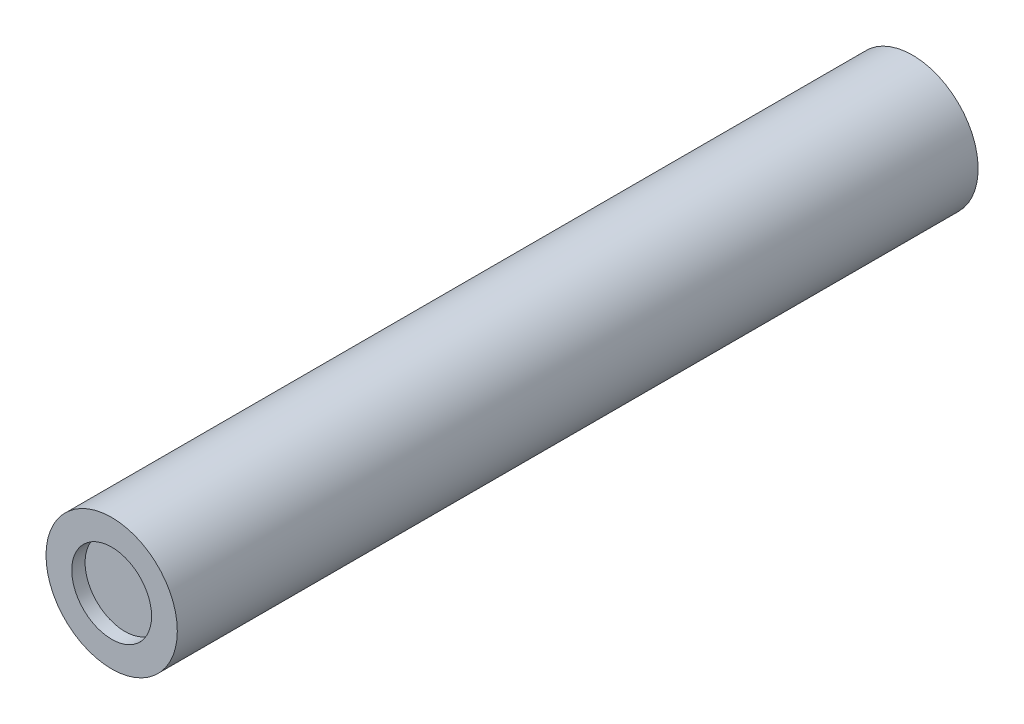
from build123d import *

# Parameters (mm, degrees)
SKETCH1_R           = 12.5
BOSS_EXTRUDE1_DEPTH = 155
SKETCH2_R           = 15.099425383
CUT_EXTRUDE1_DEPTH  = 2.54
SKETCH3_R           = 7.600027619
CUT_EXTRUDE2_DEPTH  = 2.54


with BuildPart() as part:
    # Sketch1 → Boss-Extrude1 (new body)
    with BuildSketch(Plane.XY):
        Circle(SKETCH1_R)
    extrude(amount=BOSS_EXTRUDE1_DEPTH)

    # Sketch2 → Cut-Extrude1 (cut)
    with BuildSketch(Plane(origin=(0, 0, 0), x_dir=(-1, 0, 0), z_dir=(0, 0, -1))):
        Circle(SKETCH2_R)
    extrude(amount=-CUT_EXTRUDE1_DEPTH, mode=Mode.SUBTRACT)

    # Sketch3 → Cut-Extrude2 (cut)
    with BuildSketch(Plane.XY.offset(155)):
        Circle(SKETCH3_R)
    extrude(amount=-CUT_EXTRUDE2_DEPTH, mode=Mode.SUBTRACT)


solid = part.part
